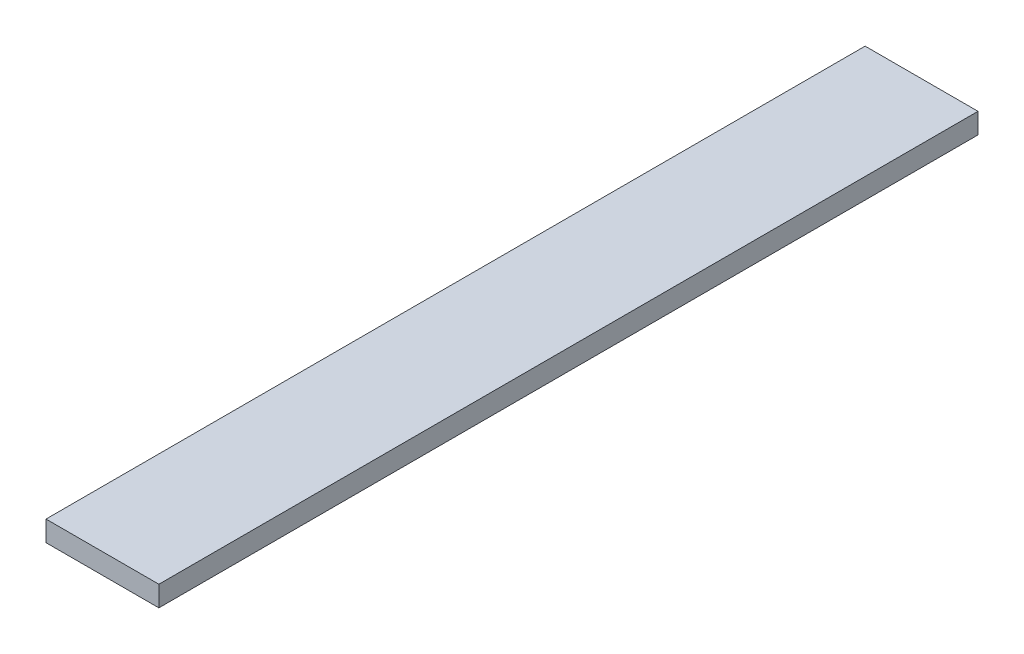
from build123d import *

# Parameters (mm, degrees)
SKETCH2_W           = 35
SKETCH2_H           = 254
BOSS_EXTRUDE1_DEPTH = 6.35


with BuildPart() as part:
    # Sketch2 → Boss-Extrude1 (new body)
    with BuildSketch(Plane(origin=(0, 0, 0), x_dir=(1, 0, 0), z_dir=(0, 1, 0))):
        with Locations((17.5, 127)):
            Rectangle(SKETCH2_W, SKETCH2_H)
    extrude(amount=BOSS_EXTRUDE1_DEPTH)


solid = part.part
